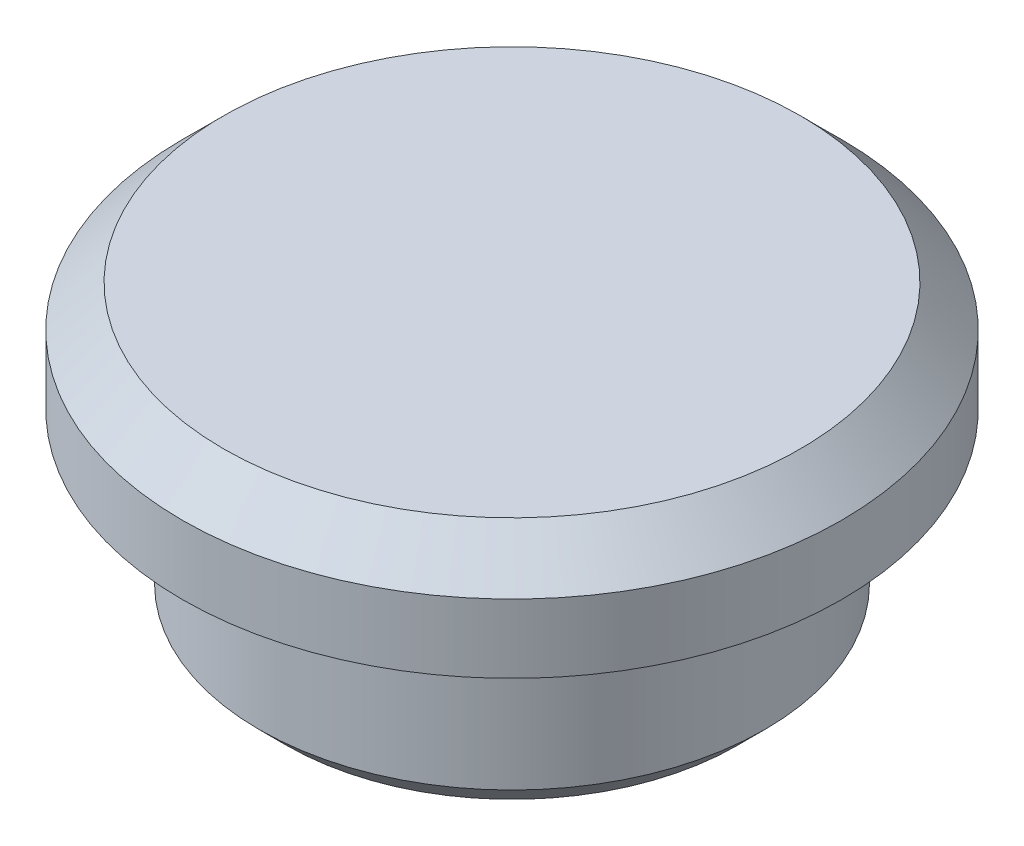
from build123d import *

# Parameters (mm, degrees)
SKETCH1_R           = 4.6736
BOSS_EXTRUDE1_DEPTH = 3.302
SKETCH2_R           = 6.096
BOSS_EXTRUDE2_DEPTH = 2.032
CHAMFER1_SIZE       = 0.762
CHAMFER2_SIZE       = 0.508


with BuildPart() as part:
    # Sketch1 → Boss-Extrude1 (new body)
    with BuildSketch(Plane(origin=(0, 0, 0), x_dir=(1, 0, 0), z_dir=(0, 1, 0))):
        with Locations(Location((0, 0, 0), (0, 0, 90))):
            Circle(SKETCH1_R)
    extrude(amount=BOSS_EXTRUDE1_DEPTH)

    # Sketch2 → Boss-Extrude2 (add)
    with BuildSketch(Plane(origin=(0, 3.302, 0), x_dir=(1, 0, 0), z_dir=(0, 1, 0))):
        with Locations(Location((0, 0, 0), (0, 0, 270))):
            Circle(SKETCH2_R)
    extrude(amount=BOSS_EXTRUDE2_DEPTH)

    # Chamfer1
    chamfer1_edges = [part.edges().sort_by_distance(p)[0] for p in [
        (0, 5.334, -6.096),
    ]]
    chamfer(chamfer1_edges, length=CHAMFER1_SIZE)

    # Chamfer2
    chamfer2_edges = [part.edges().sort_by_distance(p)[0] for p in [
        (0, 0, 4.6736),
    ]]
    chamfer(chamfer2_edges, length=CHAMFER2_SIZE)


solid = part.part
